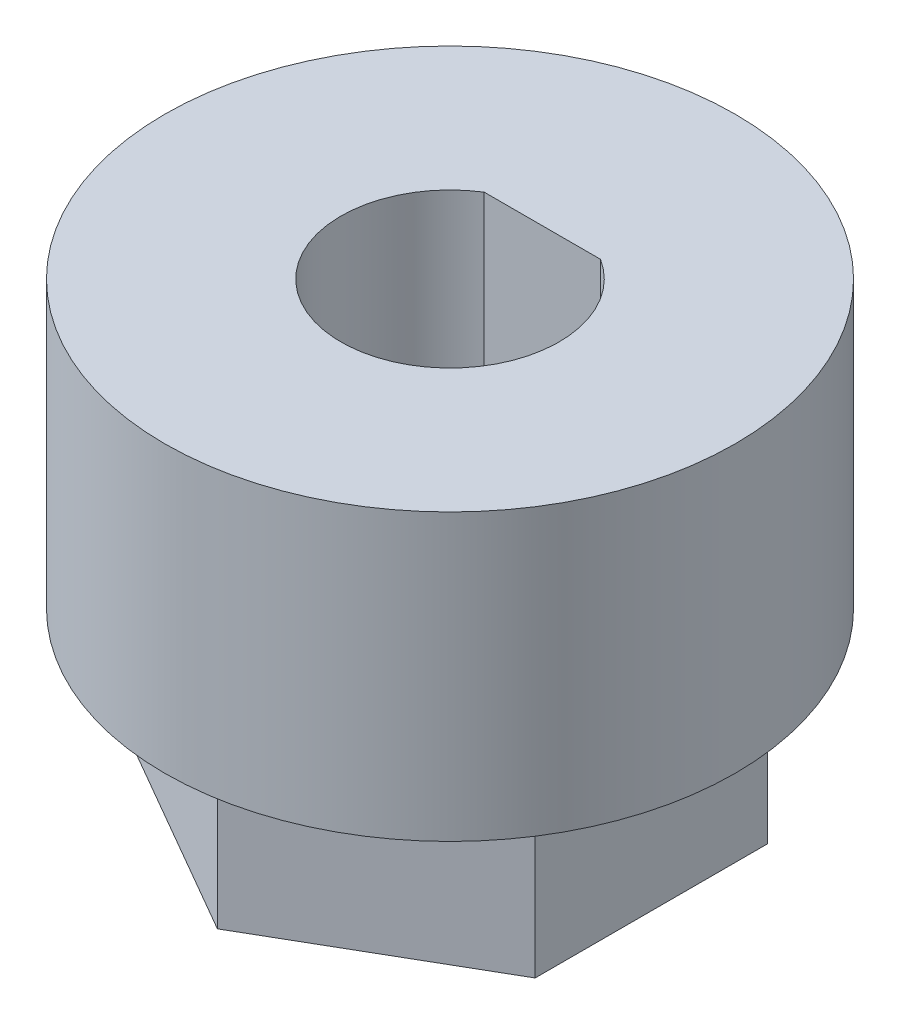
from build123d import *

# Parameters (mm, degrees)
BOSS_EXTRUDE1_DEPTH = 4.8
SKETCH2_R           = 8.5
BOSS_EXTRUDE2_DEPTH = 8.5
CUT_EXTRUDE1_DEPTH  = 18.927353402


with BuildPart() as part:
    # Sketch1 → Boss-Extrude1 (new body)
    with BuildSketch(Plane(origin=(0, 0, 0), x_dir=(1, 0, 0), z_dir=(0, 1, 0))):
        Polygon((-6, 3.464101615), (0, 6.92820323), (6, 3.464101615), (6, -3.464101615), (0, -6.92820323), (-6, -3.464101615), align=None)
    extrude(amount=BOSS_EXTRUDE1_DEPTH)

    # Sketch2 → Boss-Extrude2 (add)
    with BuildSketch(Plane(origin=(0, 4.8, 0), x_dir=(1, 0, 0), z_dir=(0, 1, 0))):
        with Locations(Location((0, 0, 0), (0, 0, 270))):
            Circle(SKETCH2_R)
    extrude(amount=BOSS_EXTRUDE2_DEPTH)

    # Sketch3 → Cut-Extrude1 (cut, through all)
    with BuildSketch(Plane(origin=(0, 13.3, 0), x_dir=(1, 0, 0), z_dir=(0, 1, 0))):
        with BuildLine():
            Line((-1.732050808, 2.75), (1.732050808, 2.75))
            ThreePointArc((1.732050808, 2.75), (0, -3.25), (-1.732050808, 2.75))
        make_face()
    extrude(amount=-CUT_EXTRUDE1_DEPTH, mode=Mode.SUBTRACT)


solid = part.part
